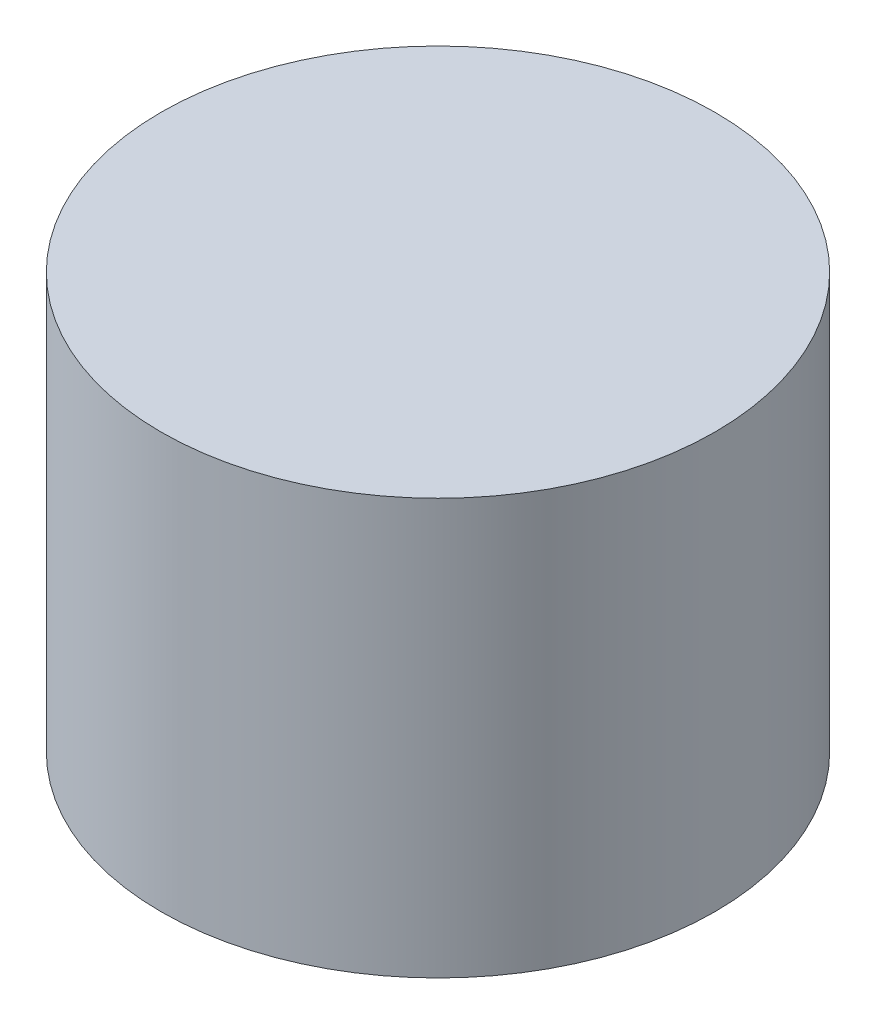
from build123d import *

# Parameters (mm, degrees)
SKETCH1_R           = 10
BOSS_EXTRUDE1_DEPTH = 15


with BuildPart() as part:
    # Sketch1 → Boss-Extrude1 (new body)
    with BuildSketch(Plane(origin=(0, 0, 0), x_dir=(1, 0, 0), z_dir=(0, 1, 0))):
        with Locations(Location((0, 0, 0), (0, 0, 270))):
            Circle(SKETCH1_R)
    extrude(amount=BOSS_EXTRUDE1_DEPTH)


solid = part.part
